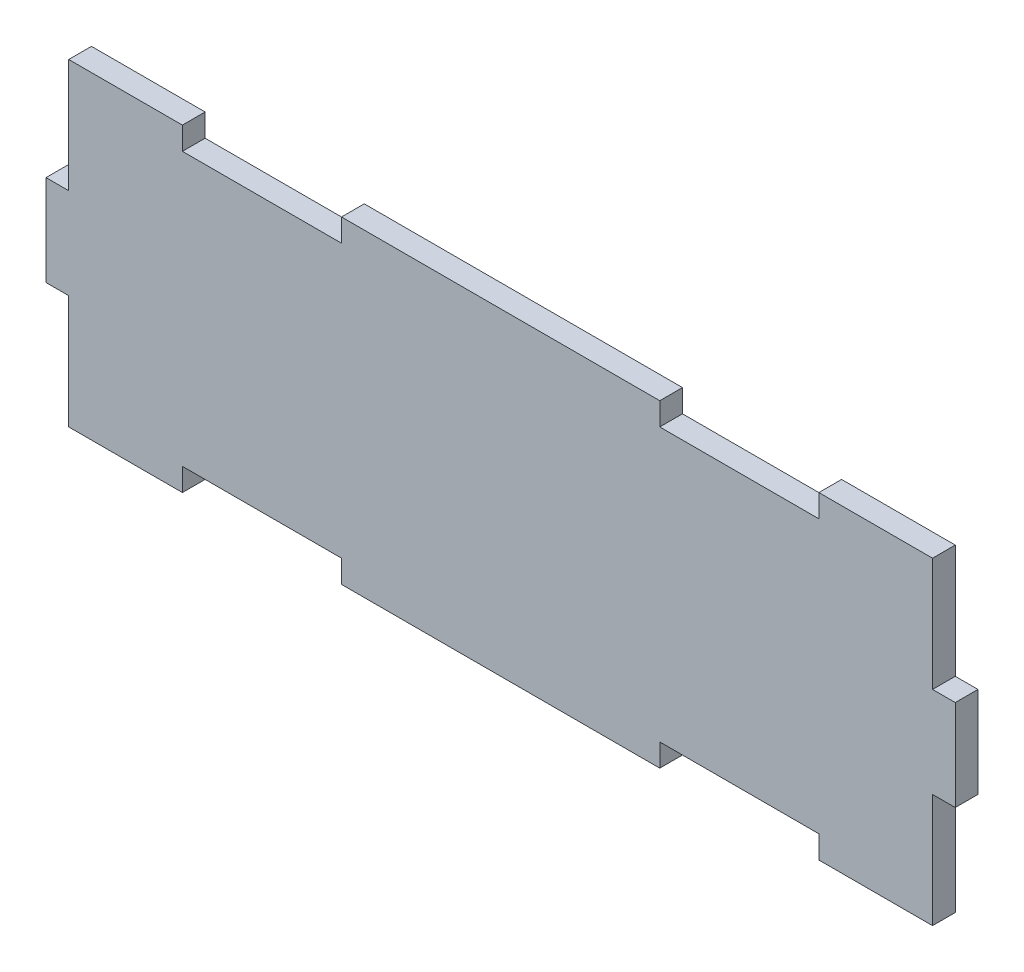
from build123d import *

# Parameters (mm, degrees)
BOSS_EXTRU_1_DEPTH = 5


with BuildPart() as part:
    # Esquisse1 → Boss.-Extru.1 (new body)
    with BuildSketch(Plane.XY):
        Polygon((-48.046218487, 55.693277311), (21.953781513, 55.693277311), (21.953781513, 50.693277311), (56.953781513, 50.693277311), (56.953781513, 55.693277311), (81.953781513, 55.693277311), (81.953781513, 30.693277311), (86.953781513, 30.693277311), (86.953781513, 10.693277311), (81.953781513, 10.693277311), (81.953781513, -14.306722689), (56.953781513, -14.306722689), (56.953781513, -9.306722689), (21.953781513, -9.306722689), (21.953781513, -14.306722689), (-48.046218487, -14.306722689), (-48.046218487, -9.306722689), (-83.046218487, -9.306722689), (-83.046218487, -14.306722689), (-108.046218487, -14.306722689), (-108.046218487, 10.693277311), (-113.046218487, 10.693277311), (-113.046218487, 30.693277311), (-108.046218487, 30.693277311), (-108.046218487, 55.693277311), (-83.046218487, 55.693277311), (-83.046218487, 50.693277311), (-48.046218487, 50.693277311), align=None)
    extrude(amount=BOSS_EXTRU_1_DEPTH)


solid = part.part
